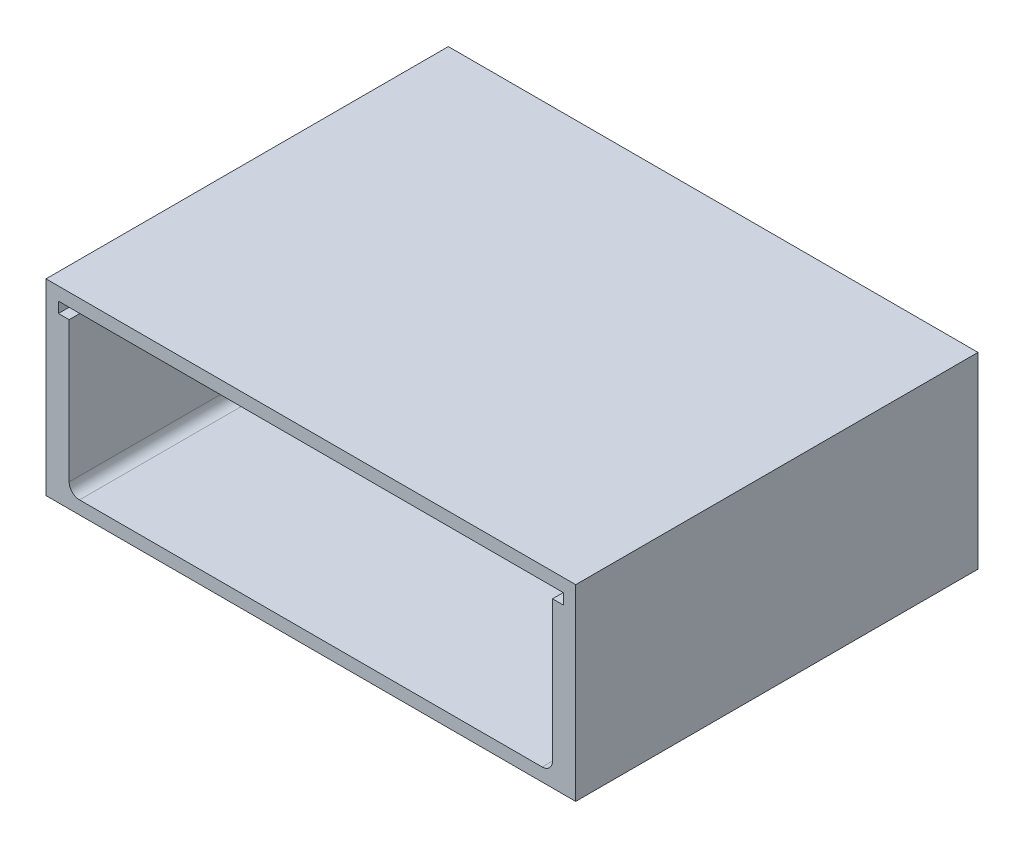
from build123d import *

# Parameters (mm, degrees)
SKETCH1_W           = 79
SKETCH1_H           = 28
BOSS_EXTRUDE1_DEPTH = 60
CUT_EXTRUDE1_DEPTH  = 46
SKETCH3_W           = 25.74
SKETCH3_H           = 3
CUT_EXTRUDE2_DEPTH  = 26
CUT_EXTRUDE3_DEPTH  = 26
FILLET1_R           = 1.55
FILLET2_R           = 2


with BuildPart() as part:
    # Sketch1 → Boss-Extrude1 (new body)
    with BuildSketch(Plane.XY):
        with Locations((39.5, 14)):
            Rectangle(SKETCH1_W, SKETCH1_H)
    extrude(amount=BOSS_EXTRUDE1_DEPTH)

    # Sketch2 → Cut-Extrude1 (cut)
    with BuildSketch(Plane.XY.offset(60)):
        Polygon((3.45, 26.05), (75.6, 26.05), (77.15, 26.05), (77.15, 24.45), (75.55, 24.45), (75.55, 1.95), (3.45, 1.95), (3.45, 24.45), (1.85, 24.45), (1.85, 26.05), align=None)
    extrude(amount=-CUT_EXTRUDE1_DEPTH, mode=Mode.SUBTRACT)

    # Sketch3 → Cut-Extrude2 (cut)
    with BuildSketch(Plane.XY.offset(14)):
        with Locations((61.13, 5)):
            Rectangle(SKETCH3_W, SKETCH3_H)
    extrude(amount=-CUT_EXTRUDE2_DEPTH, mode=Mode.SUBTRACT)

    # Sketch4 → Cut-Extrude3 (cut)
    with BuildSketch(Plane.XY.offset(14)):
        Polygon((6.45, 24.05), (72.55, 24.05), (72.55, 8.5), (46.26, 8.5), (46.26, 3.95), (6.45, 3.95), align=None)
    extrude(amount=-CUT_EXTRUDE3_DEPTH, mode=Mode.SUBTRACT)

    # Fillet1
    fillet1_edges = [part.edges().sort_by_distance(p)[0] for p in [
        (75.55, 1.95, 37),
        (3.45, 1.95, 37),
    ]]
    fillet(fillet1_edges, radius=FILLET1_R)

    # Fillet2
    fillet2_edges = [part.edges().sort_by_distance(p)[0] for p in [
        (6.45, 3.95, 7),
        (6.45, 24.05, 7),
        (72.55, 24.05, 7),
        (72.55, 8.5, 7),
        (46.26, 8.5, 7),
        (46.26, 3.95, 7),
    ]]
    fillet(fillet2_edges, radius=FILLET2_R)


solid = part.part
